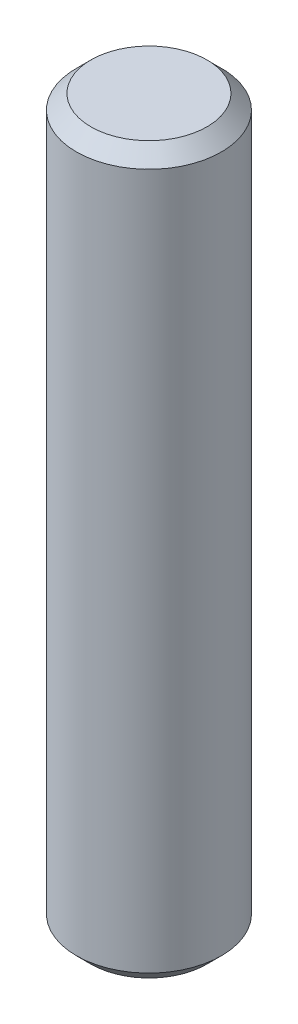
from build123d import *

# Parameters (mm, degrees)
SKETCH1_R           = 5
BOSS_EXTRUDE1_DEPTH = 50
CHAMFER1_SIZE       = 1


with BuildPart() as part:
    # Sketch1 → Boss-Extrude1 (new body)
    with BuildSketch(Plane(origin=(0, 0, 0), x_dir=(1, 0, 0), z_dir=(0, 1, 0))):
        with Locations(Location((0, 0, 0), (0, 0, 270))):
            Circle(SKETCH1_R)
    extrude(amount=BOSS_EXTRUDE1_DEPTH)

    # Chamfer1
    chamfer1_edges = [part.edges().sort_by_distance(p)[0] for p in [
        (0, 0, -5),
        (0, 50, -5),
    ]]
    chamfer(chamfer1_edges, length=CHAMFER1_SIZE)


solid = part.part
